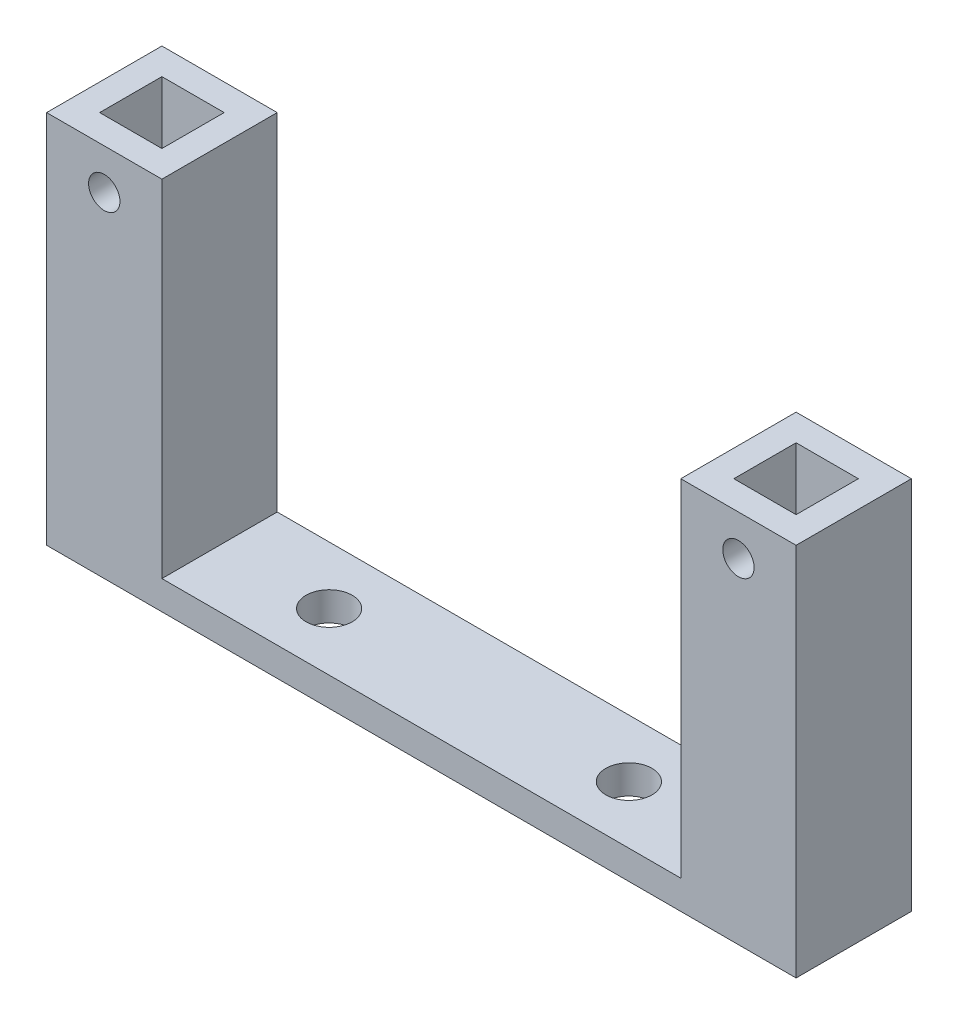
from build123d import *

# Parameters (mm, degrees)
SKETCH1_W                 = 82.55
SKETCH1_H                 = 12.7
BOSS_EXTRUDE1_DEPTH       = 3.175
SKETCH3_W                 = 12.7
SKETCH3_H                 = 12.7
BOSS_EXTRUDE2_DEPTH       = 38.1
SKETCH4_W                 = 12.7
SKETCH4_H                 = 12.7
BOSS_EXTRUDE3_DEPTH       = 38.1
SKETCH5_W                 = 6.858
SKETCH5_H                 = 6.858
CUT_EXTRUDE1_DEPTH        = 38.1
SKETCH6_W                 = 6.858
SKETCH6_H                 = 6.858
CUT_EXTRUDE2_DEPTH        = 38.1
SKETCH9_R                 = 2.54
CUT_EXTRUDE3_DEPTH        = 38.1
F_8_32_TAPPED_HOLE2_D     = 3.4544
F_8_32_TAPPED_HOLE2_DEPTH = 2.921


with BuildPart() as part:
    # Sketch1 → Boss-Extrude1 (new body)
    with BuildSketch(Plane(origin=(0, 0, 0), x_dir=(1, 0, 0), z_dir=(0, 1, 0))):
        Rectangle(SKETCH1_W, SKETCH1_H)
    extrude(amount=BOSS_EXTRUDE1_DEPTH)

    # Sketch3 → Boss-Extrude2 (add)
    with BuildSketch(Plane(origin=(0, 3.175, 0), x_dir=(1, 0, 0), z_dir=(0, 1, 0))):
        with Locations((-34.925, 0)):
            Rectangle(SKETCH3_W, SKETCH3_H)
    extrude(amount=BOSS_EXTRUDE2_DEPTH)

    # Sketch4 → Boss-Extrude3 (add)
    with BuildSketch(Plane(origin=(0, 3.175, 0), x_dir=(1, 0, 0), z_dir=(0, 1, 0))):
        with Locations((34.925, 0)):
            Rectangle(SKETCH4_W, SKETCH4_H)
    extrude(amount=BOSS_EXTRUDE3_DEPTH)

    # Sketch5 → Cut-Extrude1 (cut)
    with BuildSketch(Plane(origin=(0, 41.275, 0), x_dir=(1, 0, 0), z_dir=(0, 1, 0))):
        with Locations((-34.925, 0)):
            Rectangle(SKETCH5_W, SKETCH5_H)
    extrude(amount=-CUT_EXTRUDE1_DEPTH, mode=Mode.SUBTRACT)

    # Sketch6 → Cut-Extrude2 (cut)
    with BuildSketch(Plane(origin=(0, 41.275, 0), x_dir=(1, 0, 0), z_dir=(0, 1, 0))):
        with Locations((34.925, 0)):
            Rectangle(SKETCH6_W, SKETCH6_H)
    extrude(amount=-CUT_EXTRUDE2_DEPTH, mode=Mode.SUBTRACT)

    # Sketch9 → Cut-Extrude3 (cut)
    with BuildSketch(Plane(origin=(0, 3.175, 0), x_dir=(1, 0, 0), z_dir=(0, 1, 0))):
        with Locations(Location((-16.51, 0, 0), (0, 0, 270))):
            Circle(SKETCH9_R)
        with Locations(Location((16.51, 0, 0), (0, 0, 270))):
            Circle(SKETCH9_R)
    extrude(amount=-CUT_EXTRUDE3_DEPTH, mode=Mode.SUBTRACT)

    # #8-32 Tapped Hole2
    with Locations(Plane(origin=(-34.925, 36.83, 6.35), x_dir=(1, 0, 0), z_dir=(0, 0, 1))):
        with Locations((0, 0), (69.85, 0)):
            Hole(F_8_32_TAPPED_HOLE2_D / 2, depth=F_8_32_TAPPED_HOLE2_DEPTH)


solid = part.part
